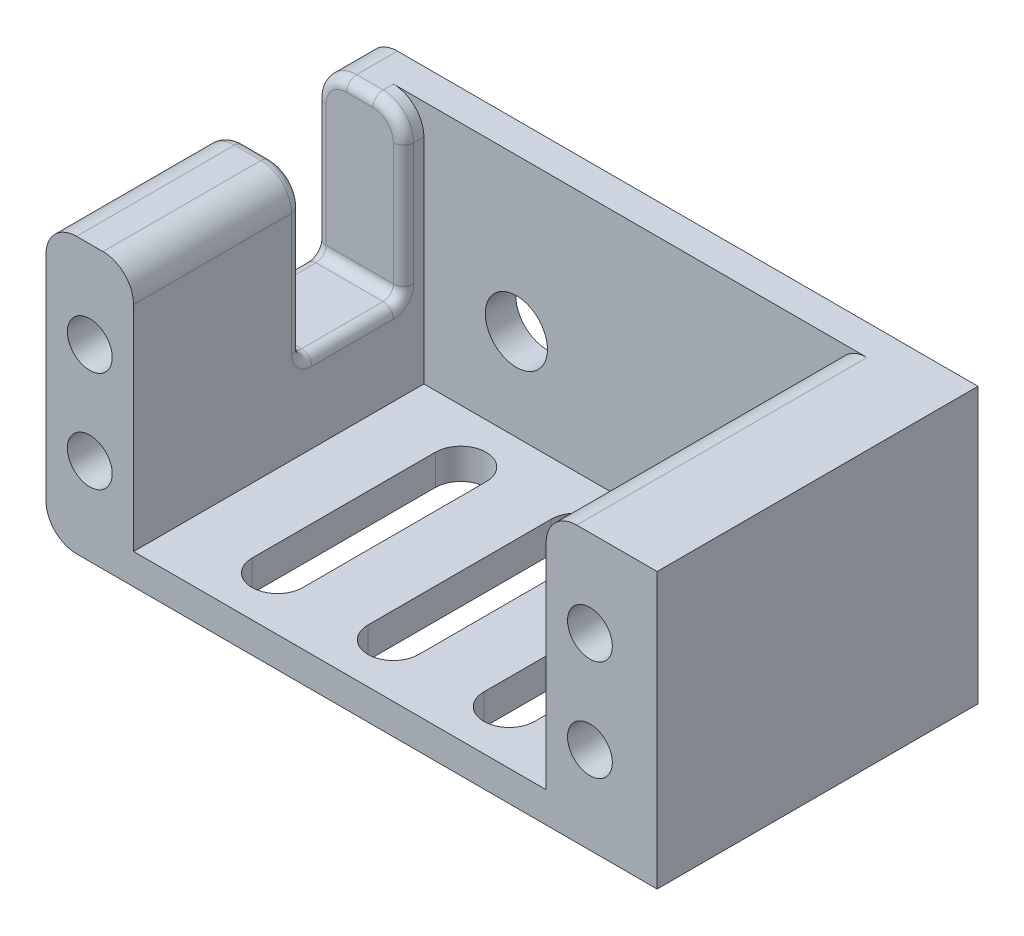
from build123d import *

# Parameters (mm, degrees)
BOSS_EXTRUDE1_DEPTH = 27
SKETCH2_R           = 2.2
CUT_EXTRUDE1_DEPTH  = 5
SKETCH4_W           = 40.5
SKETCH4_H           = 21
CUT_EXTRUDE2_DEPTH  = 28.5
SKETCH5_W           = 40.5
SKETCH5_H           = 3
CUT_EXTRUDE4_DEPTH  = 28.5
CUT_EXTRUDE7_DEPTH  = 3
SKETCH6_W           = 10
SKETCH6_H           = 16
CUT_EXTRUDE5_DEPTH  = 28.5
FILLET1_R           = 3
FILLET2_R           = 1
SKETCH9_R           = 3.05
CUT_EXTRUDE6_DEPTH  = 10


with BuildPart() as part:
    # Sketch1 → Boss-Extrude1 (new body)
    with BuildSketch(Plane(origin=(0, 0, 0), x_dir=(1, 0, 0), z_dir=(0, 1, 0))):
        Polygon((0, 0), (60, 0), (60, -31.5), (0, -31.5), (0, -26.5), (0, -3), align=None)
    extrude(amount=BOSS_EXTRUDE1_DEPTH)

    # Sketch2 → Cut-Extrude1 (cut)
    with BuildSketch(Plane.XY.offset(31.5)):
        with Locations((4.3, 18.45)):
            Circle(SKETCH2_R)
        with Locations((4.3, 8.55)):
            Circle(SKETCH2_R)
        with Locations((53.4, 18.45)):
            Circle(SKETCH2_R)
        with Locations((53.4, 8.55)):
            Circle(SKETCH2_R)
    extrude(amount=-CUT_EXTRUDE1_DEPTH, mode=Mode.SUBTRACT)

    # Sketch4 → Cut-Extrude2 (cut)
    with BuildSketch(Plane.XY.offset(31.5)):
        with Locations((28.85, 13.5)):
            Rectangle(SKETCH4_W, SKETCH4_H)
    extrude(amount=-CUT_EXTRUDE2_DEPTH, mode=Mode.SUBTRACT)

    # Sketch5 → Cut-Extrude4 (cut)
    with BuildSketch(Plane.XY.offset(31.5)):
        with Locations((28.85, 25.5)):
            Rectangle(SKETCH5_W, SKETCH5_H)
    extrude(amount=-CUT_EXTRUDE4_DEPTH, mode=Mode.SUBTRACT)

    # Sketch10 → Cut-Extrude7 (cut)
    with BuildSketch(Plane(origin=(0, 3, 0), x_dir=(1, 0, 0), z_dir=(0, 1, 0))):
        with BuildLine():
            Line((31.35, -26.25), (31.35, -8.25))
            ThreePointArc((31.35, -8.25), (28.85, -5.75), (26.35, -8.25))
            Line((26.35, -8.25), (26.35, -26.25))
            ThreePointArc((26.35, -26.25), (28.85, -28.75), (31.35, -26.25))
        make_face()
        with BuildLine():
            Line((42.73, -26.25), (42.73, -8.25))
            ThreePointArc((42.73, -8.25), (40.23, -5.75), (37.73, -8.25))
            Line((37.73, -8.25), (37.73, -26.25))
            ThreePointArc((37.73, -26.25), (40.23, -28.75), (42.73, -26.25))
        make_face()
        with BuildLine():
            Line((19.97, -26.25), (19.97, -8.25))
            ThreePointArc((19.97, -8.25), (17.47, -5.75), (14.97, -8.25))
            Line((14.97, -8.25), (14.97, -26.25))
            ThreePointArc((14.97, -26.25), (17.47, -28.75), (19.97, -26.25))
        make_face()
    extrude(amount=-CUT_EXTRUDE7_DEPTH, mode=Mode.SUBTRACT)

    # Sketch6 → Cut-Extrude5 (cut)
    with BuildSketch(Plane(origin=(8.6, 0, 0), x_dir=(0, 0, -1), z_dir=(1, 0, 0))):
        with Locations((-10, 19)):
            Rectangle(SKETCH6_W, SKETCH6_H)
    extrude(amount=-CUT_EXTRUDE5_DEPTH, mode=Mode.SUBTRACT)

    # Fillet1
    fillet1_edges = [part.edges().sort_by_distance(p)[0] for p in [
        (8.6, 27, 23.25),
        (0, 27, 23.25),
        (0, 27, 2.5),
        (8.6, 27, 4),
        (49.1, 27, 17.25),
        (0, 0, 15.75),
    ]]
    fillet(fillet1_edges, radius=FILLET1_R)

    # Fillet2
    fillet2_edges = [part.edges().sort_by_distance(p)[0] for p in [
        (4.3, 11, 15),
        (0, 17.5, 5),
        (0, 11, 10),
        (4.3, 11, 5),
        (8.6, 11, 10),
        (8.6, 17.5, 5),
        (0, 17.5, 15),
        (4.3, 27, 5),
        (7.721320344, 26.121320344, 5),
        (0.878679656, 26.121320344, 5),
        (8.6, 17.5, 15),
        (4.3, 27, 15),
        (7.721320344, 26.121320344, 15),
        (0.878679656, 26.121320344, 15),
    ]]
    fillet(fillet2_edges, radius=FILLET2_R)

    # Sketch9 → Cut-Extrude6 (cut)
    with BuildSketch(Plane(origin=(0, 0, 0), x_dir=(-1, 0, 0), z_dir=(0, 0, -1))):
        with Locations((-17.68, 12)):
            Circle(SKETCH9_R)
    extrude(amount=-CUT_EXTRUDE6_DEPTH, mode=Mode.SUBTRACT)


solid = part.part
